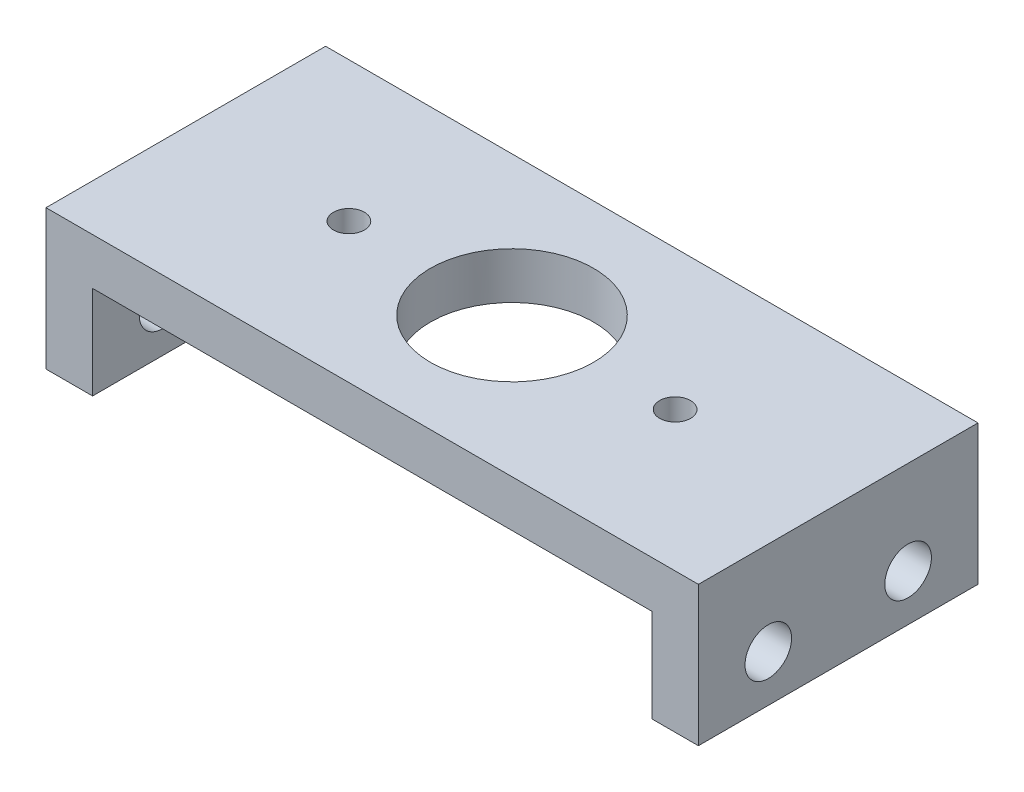
from build123d import *

# Parameters (mm, degrees)
BOSS_EXTRUDE1_DEPTH         = 76.2
F_3_8_1_75_DIAMETER_HOLE1_D = 44.45
TAP_DRILL_FOR_3_8_24_TAP1_D = 8.4328
TAP_DRILL_FOR_3_8_24_TAP2_D = 12.7


with BuildPart() as part:
    # Sketch1 → Boss-Extrude1 (new body)
    with BuildSketch(Plane.XY):
        Polygon((0, 0), (0, 38.1), (177.8, 38.1), (177.8, 0), (165.1, 0), (165.1, 25.4), (12.7, 25.4), (12.7, 0), align=None)
    extrude(amount=BOSS_EXTRUDE1_DEPTH)

    # 3/8 (1.75) Diameter Hole1 (through all)
    with Locations(Plane(origin=(0, 38.1, 0), x_dir=(1, 0, 0), z_dir=(0, 1, 0))):
        with Locations((88.9, -38.1)):
            Hole(F_3_8_1_75_DIAMETER_HOLE1_D / 2)

    # Tap Drill for 3/8-24 Tap1 (through all)
    with Locations(Plane(origin=(0, 38.1, 0), x_dir=(1, 0, 0), z_dir=(0, 1, 0))):
        with Locations((44.45, -38.1), (133.35, -38.1)):
            Hole(TAP_DRILL_FOR_3_8_24_TAP1_D / 2)

    # Tap Drill for 3/8-24 Tap2 (through all)
    with Locations(Plane(origin=(177.8, 0, 0), x_dir=(0, 0, -1), z_dir=(1, 0, 0))):
        with Locations((-57.15, 12.7), (-19.05, 12.7)):
            Hole(TAP_DRILL_FOR_3_8_24_TAP2_D / 2)


solid = part.part
